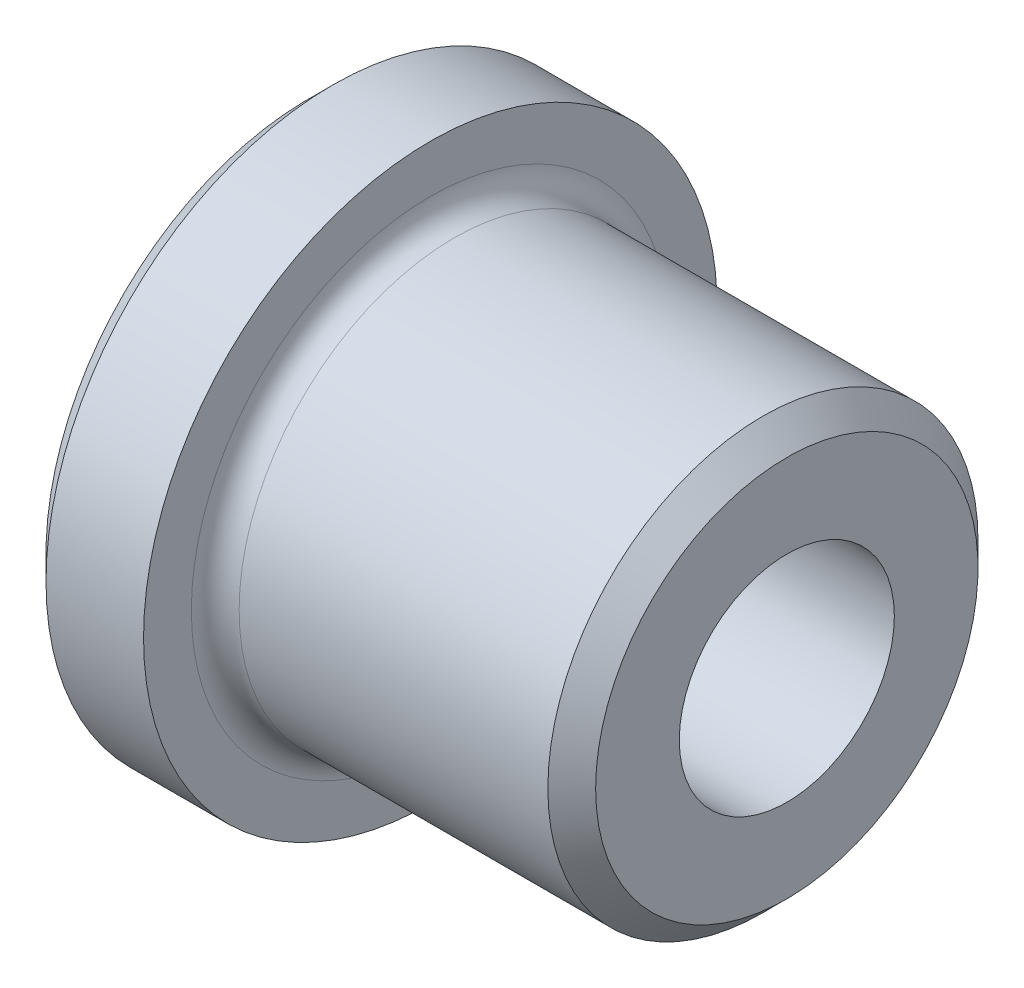
from build123d import *

# Parameters (mm, degrees)
CHAMFER1_SIZE = 0.5
FILLET1_R     = 0.5


with BuildPart() as part:
    # Sketch1 → Revolve1 (revolve)
    with BuildSketch(Plane.XY, mode=Mode.PRIVATE) as revolve1_sk:
        Polygon((0, 2.25), (0, 6), (2.540716612, 6), (2.540716612, 4.5), (10, 4.5), (10, 2.25), align=None)
    revolve(revolve1_sk.sketch.rotate(Axis((-1.743486548, 0, 0), (1, 0, 0)), 90), axis=Axis((-1.743486548, 0, 0), (1, 0, 0)))

    # Chamfer1
    chamfer1_edges = [part.edges().sort_by_distance(p)[0] for p in [
        (10, 0, -4.5),
        (0, 0, -6),
    ]]
    chamfer(chamfer1_edges, length=CHAMFER1_SIZE)

    # Fillet1
    fillet1_edges = [part.edges().sort_by_distance(p)[0] for p in [
        (2.540716612, 0, -4.5),
    ]]
    fillet(fillet1_edges, radius=FILLET1_R)


solid = part.part
